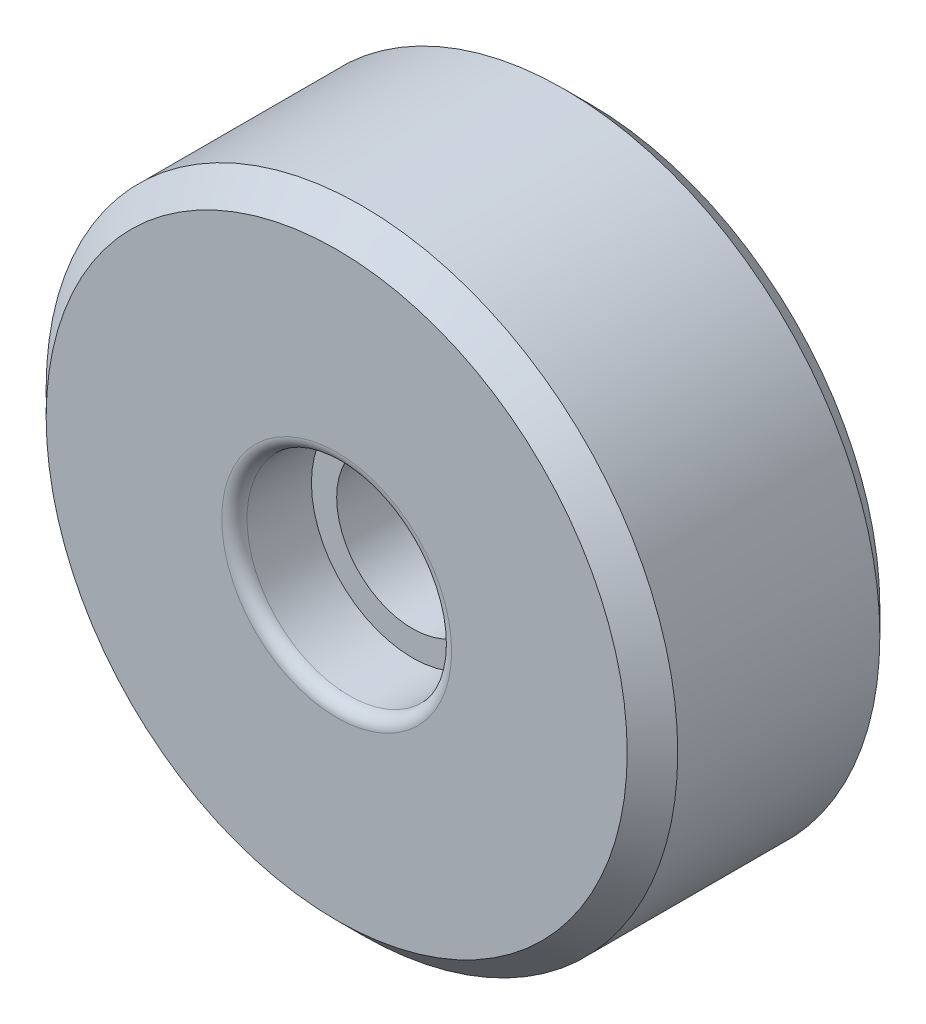
from build123d import *

# Parameters (mm, degrees)
SKETCH_1_R      = 12.5
SKETCH_1_R_2    = 4.05
EXTRUDE_1_DEPTH = 10
SKETCH_2_R      = 4
SKETCH_2_R_2    = 3
EXTRUDE_2_DEPTH = 7
CHAMFER_1_SIZE  = 1
FILLET_1_R      = 0.5


with BuildPart() as part:
    # 草图1 → 凸台-拉伸1 (new body)
    with BuildSketch(Plane.XY):
        Circle(SKETCH_1_R)
        Circle(SKETCH_1_R_2, mode=Mode.SUBTRACT)
    extrude(amount=EXTRUDE_1_DEPTH)

    # 倒角1
    chamfer_1_edges = [part.edges().sort_by_distance(p)[0] for p in [
        (-12.5, 0, 0),
        (-12.5, 0, 10),
    ]]
    chamfer(chamfer_1_edges, length=CHAMFER_1_SIZE)

    # 圆角1
    fillet_1_edges = [part.edges().sort_by_distance(p)[0] for p in [
        (-4.05, 0, 10),
    ]]
    fillet(fillet_1_edges, radius=FILLET_1_R)


with BuildPart() as body_2:
    # 草图2 → 凸台-拉伸2 (new body)
    with BuildSketch(Plane(origin=(0, 0, 0), x_dir=(-1, 0, 0), z_dir=(0, 0, -1))):
        Circle(SKETCH_2_R)
        Circle(SKETCH_2_R_2, mode=Mode.SUBTRACT)
    extrude(amount=-EXTRUDE_2_DEPTH)


solid = Compound([part.part, body_2.part])
